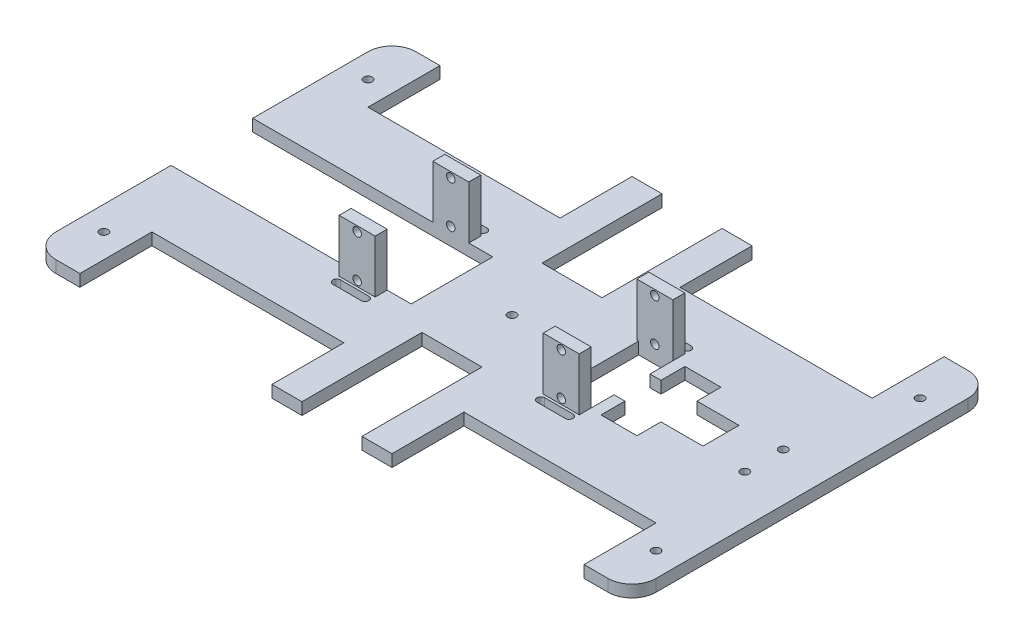
from build123d import *

# Parameters (mm, degrees)
SKETCH_1_W                                 = 250
SKETCH_1_H                                 = 150
EXTRUDE_1_DEPTH                            = 5
SKETCH_2_W                                 = 15
SKETCH_2_H                                 = 22
EXTRUDE_2_DEPTH                            = 5
MIRROR_2_COPY_1_SKETCH_W                   = 15
MIRROR_2_COPY_1_SKETCH_H                   = 22
MIRROR_2_COPY_1_DEPTH                      = 5
SKETCH_7_R                                 = 1.75
CUT_EXTRUDE_1_DEPTH                        = 148.424556977
MIRROR_4_COPY_1_SKETCH_R                   = 1.75
MIRROR_4_COPY_1_DEPTH                      = 148.424556977
FILLET_1_R                                 = 10
SKETCH_12_W                                = 30
SKETCH_12_H                                = 11
EXTRUDE_4_DEPTH                            = 3
SKETCH_13_W                                = 30
SKETCH_13_H                                = 3
EXTRUDE_5_DEPTH                            = 50
CUT_EXTRUDE_4_DEPTH                        = 192.065433818
CUT_EXTRUDE_4_DEPTH_BACK                   = 192.065433818
SKETCH_16_R                                = 1.75
CUT_EXTRUDE_5_DEPTH                        = 182.950542731
CUT_EXTRUDE_6_DEPTH                        = 182.950542731
CUT_EXTRUDE_6_DEPTH_BACK                   = 5
SKETCH_19_W                                = 6
SKETCH_19_H                                = 20
SKETCH_21_W                                = 210
SKETCH_21_H                                = 30
CUT_EXTRUDE_8_DEPTH                        = 5
SKETCH_23_W                                = 50
SKETCH_23_H                                = 30
EXTRUDE_6_DEPTH                            = 5
SKETCH_24_W                                = 25
SKETCH_24_H                                = 50
CUT_EXTRUDE_9_DEPTH                        = 5
SKETCH_25_W                                = 100
SKETCH_25_H                                = 34
CUT_EXTRUDE_10_DEPTH                       = 5
SKETCH_26_W                                = 50
SKETCH_26_H                                = 15
SKETCH_26_W_2                              = 15
SKETCH_26_H_2                              = 35
CUT_EXTRUDE_11_DEPTH                       = 5
SKETCH_27_R                                = 1.75
CUT_EXTRUDE_12_DEPTH                       = 5
SKETCH_29_R                                = 1.75
CUT_EXTRUDE_13_DEPTH                       = 5
MIRROR_12_AT_THE_SECOND_PLANE_COPY_1_SKE_R = 1.75
MIRROR_12_AT_THE_SECOND_PLANE_COPY_1_DEPTH = 5
CUT_EXTRUDE_14_DEPTH                       = 5
MIRROR_13_AT_THE_SECOND_PLANE_COPY_1_DEPTH = 5
SKETCH_33_W                                = 14.233651272
SKETCH_33_H                                = 34
CUT_EXTRUDE_15_DEPTH                       = 5
SKETCH_34_R                                = 1.75
CUT_EXTRUDE_16_DEPTH                       = 10
SKETCH_35_W                                = 30
SKETCH_35_H                                = 11
CUT_EXTRUDE_17_DEPTH                       = 65


with BuildPart() as part:
    # 草图1 → 凸台-拉伸1 (new body)
    with BuildSketch(Plane(origin=(0, 0, 0), x_dir=(1, 0, 0), z_dir=(0, 1, 0))):
        Rectangle(SKETCH_1_W, SKETCH_1_H)
    extrude(amount=EXTRUDE_1_DEPTH)

    # 草图2 → 凸台-拉伸2 (add)
    with BuildSketch(Plane.XY.offset(22)):
        with Locations((-42.5, 16)):
            Rectangle(SKETCH_2_W, SKETCH_2_H)
    extrude_2 = extrude(amount=-EXTRUDE_2_DEPTH)

    # 镜向1: 凸台-拉伸2 across plane
    add(extrude_2.mirror(Plane.XY))

    # 镜向2: 凸台-拉伸2 across plane
    add(extrude_2.mirror(Plane(origin=(0, 0, 0), x_dir=(0, 0, 1), z_dir=(1, 0, 0))))

    # 镜向2 copy 1 sketch → 镜向2 copy 1 (add)
    with BuildSketch(Plane(origin=(0, 0, -22), x_dir=(-1, 0, 0), z_dir=(0, 0, -1))):
        with Locations((-42.5, 16)):
            Rectangle(MIRROR_2_COPY_1_SKETCH_W, MIRROR_2_COPY_1_SKETCH_H)
    extrude(amount=-MIRROR_2_COPY_1_DEPTH)

    # 草图7 → 切除-拉伸1 (cut, symmetric)
    with BuildSketch(Plane(origin=(0, 5, 0), x_dir=(1, 0, 0), z_dir=(0, 1, 0))):
        with Locations(Location((-115, -55, 0), (0, 0, 270))):
            Circle(SKETCH_7_R)
    cut_extrude_1 = extrude(amount=CUT_EXTRUDE_1_DEPTH, both=True, mode=Mode.SUBTRACT)

    # 镜向3: 切除-拉伸1 across plane
    add(cut_extrude_1.mirror(Plane.XY), mode=Mode.SUBTRACT)

    # 镜向4: 切除-拉伸1 across plane
    add(cut_extrude_1.mirror(Plane(origin=(0, 0, 0), x_dir=(0, 0, 1), z_dir=(1, 0, 0))), mode=Mode.SUBTRACT)

    # 镜向4 copy 1 sketch → 镜向4 copy 1 (cut, symmetric)
    with BuildSketch(Plane(origin=(0, 5, 0), x_dir=(-1, 0, 0), z_dir=(0, 1, 0))):
        with Locations(Location((-115, -55, 0), (0, 0, 270))):
            Circle(MIRROR_4_COPY_1_SKETCH_R)
    extrude(amount=MIRROR_4_COPY_1_DEPTH, both=True, mode=Mode.SUBTRACT)

    # 圆角1
    fillet_1_edges = [part.edges().sort_by_distance(p)[0] for p in [
        (-125, 2.5, -75),
        (125, 2.5, -75),
        (125, 2.5, 75),
        (-125, 2.5, 75),
    ]]
    fillet(fillet_1_edges, radius=FILLET_1_R)

    # 草图12 → 凸台-拉伸4 (add)
    with BuildSketch(Plane(origin=(125, 0, 0), x_dir=(0, 0, -1), z_dir=(1, 0, 0))):
        with Locations((0, 10.5)):
            Rectangle(SKETCH_12_W, SKETCH_12_H)
    extrude(amount=-EXTRUDE_4_DEPTH)

    # 草图13 → 凸台-拉伸5 (add)
    with BuildSketch(Plane(origin=(125, 0, 0), x_dir=(0, 0, -1), z_dir=(1, 0, 0))):
        with Locations((0, 14.5)):
            Rectangle(SKETCH_13_W, SKETCH_13_H)
    extrude(amount=EXTRUDE_5_DEPTH)

    # 草图15 → 切除-拉伸4 (cut, two sides: drawn at the far end of the back side and taken through both)
    with BuildSketch(Plane(origin=(0, 16, 0), x_dir=(1, 0, 0), z_dir=(0, 1, 0)).offset(-CUT_EXTRUDE_4_DEPTH_BACK)):
        Polygon((165, 632.289058028), (165, 15), (165, -15), (165, -632.289058028), (1399.578116055, -632.289058028), (1399.578116055, 632.289058028), align=None)
    extrude(amount=CUT_EXTRUDE_4_DEPTH + CUT_EXTRUDE_4_DEPTH_BACK, mode=Mode.SUBTRACT)

    # 草图16 → 切除-拉伸5 (cut, symmetric)
    with BuildSketch(Plane(origin=(0, 16, 0), x_dir=(1, 0, 0), z_dir=(0, 1, 0))):
        with Locations(Location((135, 8, 0), (0, 0, 270))):
            Circle(SKETCH_16_R)
        with Locations(Location((155, 8, 0), (0, 0, 270))):
            Circle(SKETCH_16_R)
    cut_extrude_5 = extrude(amount=CUT_EXTRUDE_5_DEPTH, both=True, mode=Mode.SUBTRACT)

    # 镜向7: 切除-拉伸5 across plane
    add(cut_extrude_5.mirror(Plane.XY), mode=Mode.SUBTRACT)

    # 草图19 → 切除-拉伸6 (cut, two sides: drawn at the far end of the back side and taken through both)
    with BuildSketch(Plane(origin=(0, 16, 0), x_dir=(1, 0, 0), z_dir=(0, 1, 0)).offset(-CUT_EXTRUDE_6_DEPTH_BACK)):
        with Locations((125, 0)):
            Rectangle(SKETCH_19_W, SKETCH_19_H)
    extrude(amount=CUT_EXTRUDE_6_DEPTH + CUT_EXTRUDE_6_DEPTH_BACK, mode=Mode.SUBTRACT)

    # 草图21 → 切除-拉伸8 (cut)
    with BuildSketch(Plane(origin=(0, 5, 0), x_dir=(1, 0, 0), z_dir=(0, 1, 0))):
        with Locations((0, -60)):
            Rectangle(SKETCH_21_W, SKETCH_21_H)
    cut_extrude_8 = extrude(amount=-CUT_EXTRUDE_8_DEPTH, mode=Mode.SUBTRACT)

    # 草图23 → 凸台-拉伸6 (add)
    with BuildSketch(Plane(origin=(0, 5, 0), x_dir=(1, 0, 0), z_dir=(0, 1, 0))):
        with Locations((0, -60)):
            Rectangle(SKETCH_23_W, SKETCH_23_H)
    extrude_6 = extrude(amount=-EXTRUDE_6_DEPTH)

    # 镜向10: 切除-拉伸8, 凸台-拉伸6 across plane
    add(cut_extrude_8.mirror(Plane.XY), mode=Mode.SUBTRACT)
    add(extrude_6.mirror(Plane.XY))

    # 草图24 → 切除-拉伸9 (cut)
    with BuildSketch(Plane(origin=(0, 5, 0), x_dir=(1, 0, 0), z_dir=(0, 1, 0))):
        with Locations((0, 50)):
            Rectangle(SKETCH_24_W, SKETCH_24_H)
    cut_extrude_9 = extrude(amount=-CUT_EXTRUDE_9_DEPTH, mode=Mode.SUBTRACT)

    # 镜向11: 切除-拉伸9 across plane
    add(cut_extrude_9.mirror(Plane.XY), mode=Mode.SUBTRACT)

    # 草图25 → 切除-拉伸10 (cut)
    with BuildSketch(Plane(origin=(0, 5, 0), x_dir=(1, 0, 0), z_dir=(0, 1, 0))):
        with Locations((-75, 0)):
            Rectangle(SKETCH_25_W, SKETCH_25_H)
    extrude(amount=-CUT_EXTRUDE_10_DEPTH, mode=Mode.SUBTRACT)

    # 草图26 → 切除-拉伸11 (cut)
    with BuildSketch(Plane(origin=(0, 5, 0), x_dir=(1, 0, 0), z_dir=(0, 1, 0))):
        with Locations((62.054344838, 0)):
            Rectangle(SKETCH_26_W, SKETCH_26_H)
        with Locations((62.054344838, 0)):
            Rectangle(SKETCH_26_W_2, SKETCH_26_H_2)
    extrude(amount=-CUT_EXTRUDE_11_DEPTH, mode=Mode.SUBTRACT)

    # 草图27 → 切除-拉伸12 (cut)
    with BuildSketch(Plane(origin=(0, 5, 0), x_dir=(1, 0, 0), z_dir=(0, 1, 0))):
        with Locations(Location((0, 0, 0), (0, 0, 270))):
            Circle(SKETCH_27_R)
    extrude(amount=-CUT_EXTRUDE_12_DEPTH, mode=Mode.SUBTRACT)

    # 草图29 → 切除-拉伸13 (cut)
    with BuildSketch(Plane.XY.offset(22)):
        with Locations((-42.5, 24.75)):
            Circle(SKETCH_29_R)
        with Locations((-42.5, 7.25)):
            Circle(SKETCH_29_R)
    cut_extrude_13 = extrude(amount=-CUT_EXTRUDE_13_DEPTH, mode=Mode.SUBTRACT)

    # 镜向12: 切除-拉伸13 across plane
    add(cut_extrude_13.mirror(Plane(origin=(0, 0, 0), x_dir=(0, 0, 1), z_dir=(1, 0, 0))), mode=Mode.SUBTRACT)

    # 镜向12 at the second plane: 切除-拉伸13 across plane
    add(cut_extrude_13.mirror(Plane.XY), mode=Mode.SUBTRACT)

    # 镜向12 at the second plane copy 1 ske → 镜向12 at the second plane copy 1 (cut)
    with BuildSketch(Plane(origin=(0, 0, -22), x_dir=(-1, 0, 0), z_dir=(0, 0, -1))):
        with Locations((-42.5, 24.75)):
            Circle(MIRROR_12_AT_THE_SECOND_PLANE_COPY_1_SKE_R)
        with Locations((-42.5, 7.25)):
            Circle(MIRROR_12_AT_THE_SECOND_PLANE_COPY_1_SKE_R)
    extrude(amount=-MIRROR_12_AT_THE_SECOND_PLANE_COPY_1_DEPTH, mode=Mode.SUBTRACT)

    # 草图32 → 切除-拉伸14 (cut)
    with BuildSketch(Plane(origin=(0, 5, 0), x_dir=(1, 0, 0), z_dir=(0, 1, 0))):
        with BuildLine():
            Line((-48.4, 26.2), (-36.6, 26.2))
            ThreePointArc((-36.6, 26.2), (-35, 24.6), (-36.6, 23))
            Line((-36.6, 23), (-48.4, 23))
            ThreePointArc((-48.4, 23), (-50, 24.6), (-48.4, 26.2))
        make_face()
    cut_extrude_14 = extrude(amount=-CUT_EXTRUDE_14_DEPTH, mode=Mode.SUBTRACT)

    # 镜向13: 切除-拉伸14 across plane
    add(cut_extrude_14.mirror(Plane(origin=(0, 0, 0), x_dir=(0, 0, 1), z_dir=(1, 0, 0))), mode=Mode.SUBTRACT)

    # 镜向13 at the second plane: 切除-拉伸14 across plane
    add(cut_extrude_14.mirror(Plane.XY), mode=Mode.SUBTRACT)

    # 镜向13 at the second plane copy 1 ske → 镜向13 at the second plane copy 1 (cut)
    with BuildSketch(Plane(origin=(0, 5, 0), x_dir=(-1, 0, 0), z_dir=(0, 1, 0))):
        with BuildLine():
            Line((-48.4, 26.2), (-36.6, 26.2))
            ThreePointArc((-36.6, 26.2), (-35, 24.6), (-36.6, 23))
            Line((-36.6, 23), (-48.4, 23))
            ThreePointArc((-48.4, 23), (-50, 24.6), (-48.4, 26.2))
        make_face()
    extrude(amount=-MIRROR_13_AT_THE_SECOND_PLANE_COPY_1_DEPTH, mode=Mode.SUBTRACT)

    # 草图33 → 切除-拉伸15 (cut)
    with BuildSketch(Plane(origin=(0, 5, 0), x_dir=(1, 0, 0), z_dir=(0, 1, 0))):
        with Locations((42.883174364, 0)):
            Rectangle(SKETCH_33_W, SKETCH_33_H)
    extrude(amount=-CUT_EXTRUDE_15_DEPTH, mode=Mode.SUBTRACT)

    # 草图34 → 切除-拉伸16 (cut)
    with BuildSketch(Plane(origin=(0, 5, 0), x_dir=(1, 0, 0), z_dir=(0, 1, 0))):
        with Locations(Location((105, 8, 0), (0, 0, 270))):
            Circle(SKETCH_34_R)
        with Locations(Location((105, -8, 0), (0, 0, 270))):
            Circle(SKETCH_34_R)
    extrude(amount=-CUT_EXTRUDE_16_DEPTH, mode=Mode.SUBTRACT)

    # 草图35 → 切除-拉伸17 (cut)
    with BuildSketch(Plane.ZY.offset(-122)):
        with Locations((0, 10.5)):
            Rectangle(SKETCH_35_W, SKETCH_35_H)
    extrude(amount=-CUT_EXTRUDE_17_DEPTH, mode=Mode.SUBTRACT)


solid = part.part
